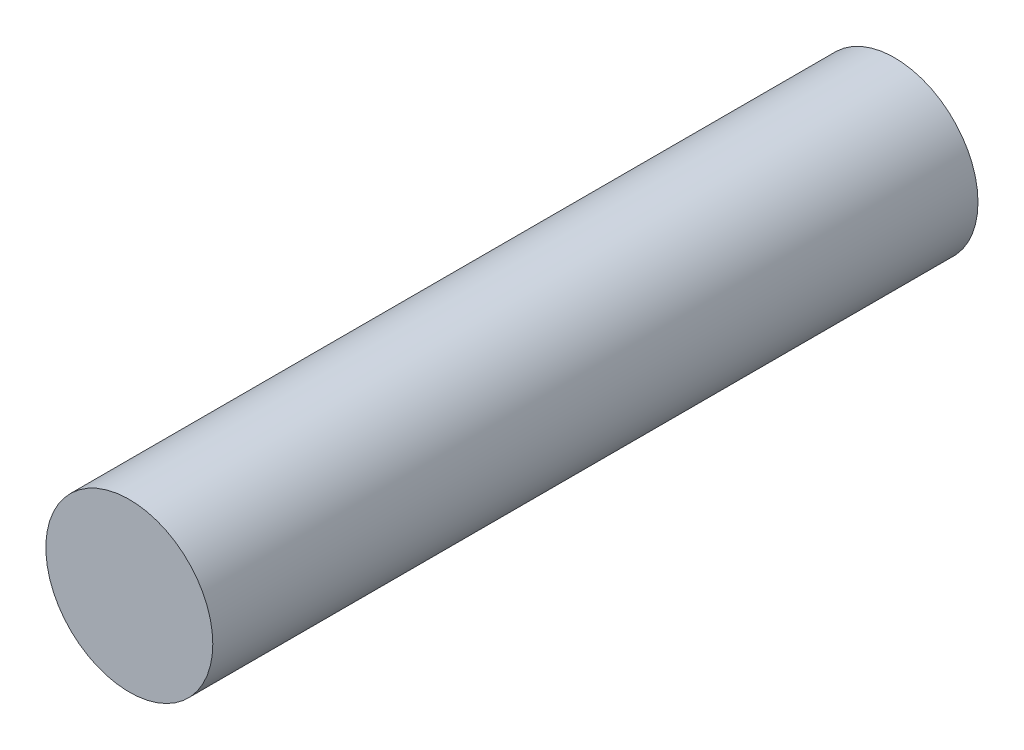
from build123d import *

# Parameters (mm, degrees)
CROQUIS1_R              = 6
SALIENTE_EXTRUIR1_DEPTH = 55


with BuildPart() as part:
    # Croquis1 → Saliente-Extruir1 (new body)
    with BuildSketch(Plane.XY):
        Circle(CROQUIS1_R)
    extrude(amount=SALIENTE_EXTRUIR1_DEPTH)


solid = part.part
